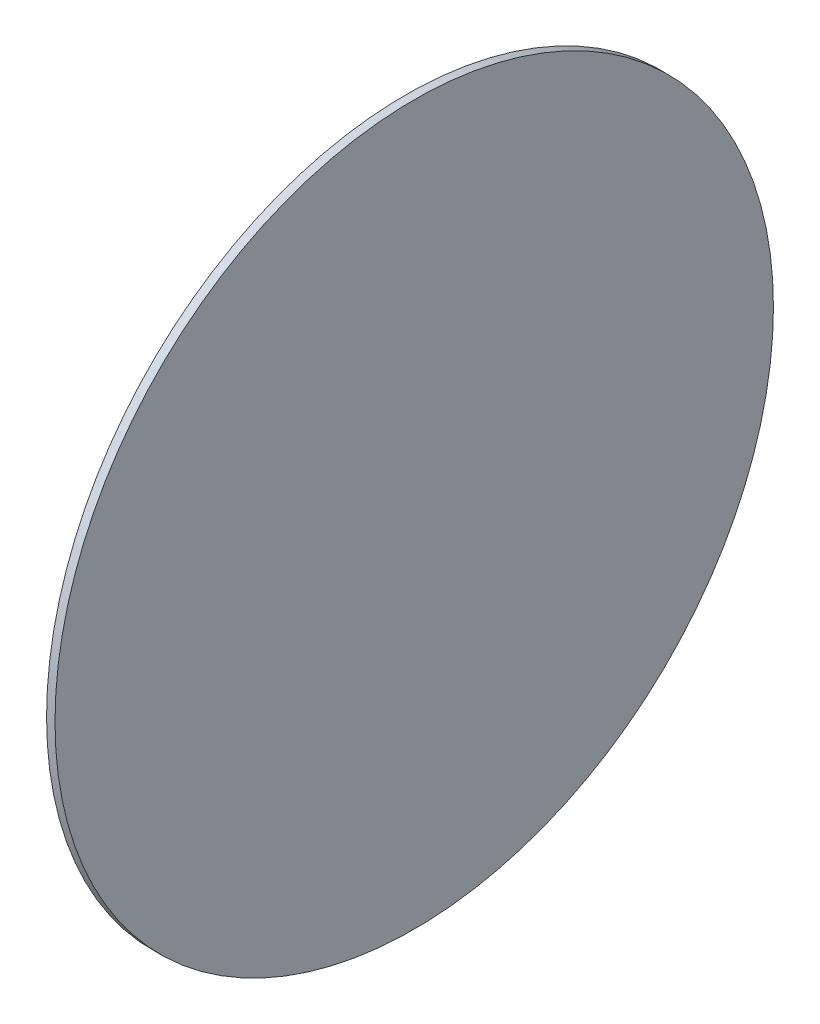
from build123d import *

# Parameters (mm, degrees)
SKETCH1_R           = 85.344
BOSS_EXTRUDE1_DEPTH = 2.0066


with BuildPart() as part:
    # Sketch1 → Boss-Extrude1 (new body)
    with BuildSketch(Plane.YZ):
        with Locations(Location((0, 0, 0), (0, 0, 270))):
            Circle(SKETCH1_R)
    extrude(amount=BOSS_EXTRUDE1_DEPTH)


solid = part.part
